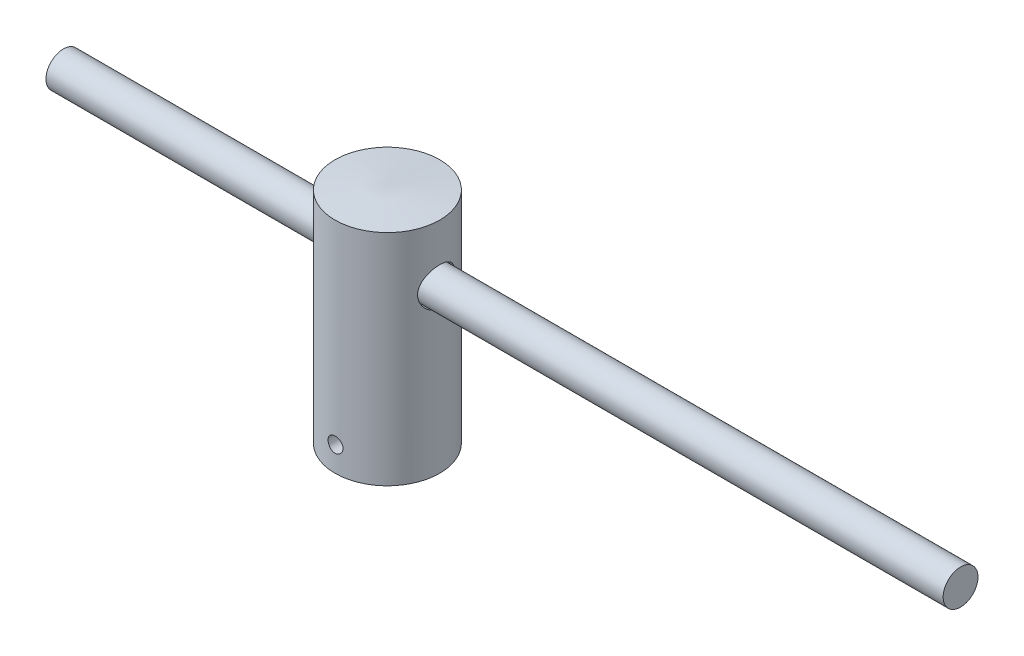
from build123d import *

# Parameters (mm, degrees)
CUT_EXTRUDE2_DEPTH       = 95.773413994
CUT_EXTRUDE2_DEPTH_BACK  = 95.773413994
SKETCH3_R                = 7.5
BOSS_EXTRUDE1_DEPTH      = 230
BOSS_EXTRUDE1_DEPTH_BACK = 130
SKETCH5_R                = 6.992090562
SKETCH7_R                = 3
CUT_EXTRUDE3_DEPTH       = 248.872951336


with BuildPart() as part:
    # Sketch1 → Revolve1 (revolve)
    with BuildSketch(Plane.XY, mode=Mode.PRIVATE) as revolve1_sk:
        Polygon((-6, 0), (-21, 0), (-21, 88), (0, 90), (0, 35), (-6, 35), align=None)
    revolve(revolve1_sk.sketch.rotate(Axis((0, 19.249426994, 0), (0, -1, 0)), 270), axis=Axis((0, 19.249426994, 0), (0, -1, 0)))

    # Sketch3 → Cut-Extrude2 (cut, two sides: drawn at the far end of the back side and taken through both)
    with BuildSketch(Plane(origin=(0, 0, 0), x_dir=(0, 0, -1), z_dir=(1, 0, 0)).offset(-CUT_EXTRUDE2_DEPTH_BACK)):
        with Locations((0, 65)):
            Circle(SKETCH3_R)
    extrude(amount=CUT_EXTRUDE2_DEPTH + CUT_EXTRUDE2_DEPTH_BACK, mode=Mode.SUBTRACT)

    # Sketch7 → Cut-Extrude3 (cut, through all)
    with BuildSketch(Plane.XY):
        with Locations(Location((0, 10, 0), (0, 0, 270))):
            Circle(SKETCH7_R)
    extrude(amount=CUT_EXTRUDE3_DEPTH, mode=Mode.SUBTRACT)


with BuildPart() as body_2:
    # Sketch5 → Boss-Extrude1 (new, two sides: drawn at the far end of the back side and taken through both)
    with BuildSketch(Plane(origin=(0, 0, 0), x_dir=(0, 0, -1), z_dir=(1, 0, 0)).offset(-BOSS_EXTRUDE1_DEPTH_BACK)):
        with Locations((0, 65)):
            Circle(SKETCH5_R)
    extrude(amount=BOSS_EXTRUDE1_DEPTH + BOSS_EXTRUDE1_DEPTH_BACK)


solid = Compound([part.part, body_2.part])
